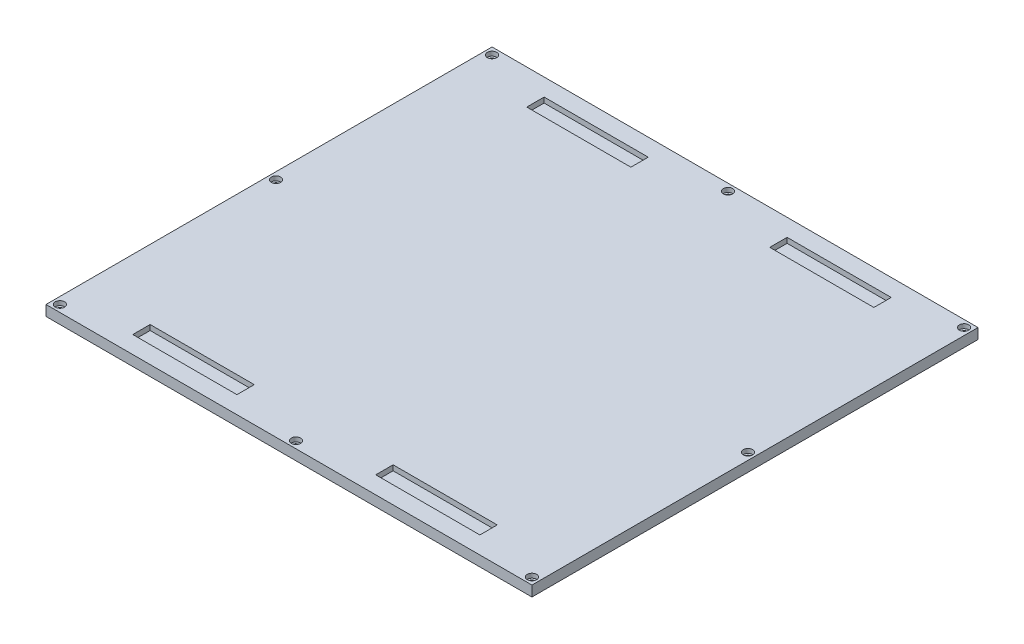
from build123d import *

# Parameters (mm, degrees)
SKETCH1_W           = 280
SKETCH1_H           = 257
BOSS_EXTRUDE2_DEPTH = 6
SKETCH3_R           = 1.45
CUT_EXTRUDE1_DEPTH  = 381.111825651
SKETCH4_R           = 2.7
CUT_EXTRUDE4_DEPTH  = 2.5
SKETCH8_W           = 60
SKETCH8_H           = 10
CUT_EXTRUDE5_DEPTH  = 3


with BuildPart() as part:
    # Sketch1 → Boss-Extrude2 (new body)
    with BuildSketch(Plane(origin=(0, 0, 0), x_dir=(1, 0, 0), z_dir=(0, 1, 0))):
        with Locations((140, 128.5)):
            Rectangle(SKETCH1_W, SKETCH1_H)
    extrude(amount=BOSS_EXTRUDE2_DEPTH)

    # Sketch3 → Cut-Extrude1 (cut, through all)
    with BuildSketch(Plane(origin=(0, 6, 0), x_dir=(1, 0, 0), z_dir=(0, 1, 0))):
        with Locations(Location((4.002224382, 252.997775618, 0), (0, 0, 270))):
            Circle(SKETCH3_R)
        with Locations(Location((275.997775618, 252.997775618, 0), (0, 0, 270))):
            Circle(SKETCH3_R)
        with Locations(Location((4.002224382, 4.002224382, 0), (0, 0, 270))):
            Circle(SKETCH3_R)
        with Locations(Location((275.997775618, 4.002224382, 0), (0, 0, 270))):
            Circle(SKETCH3_R)
        with Locations(Location((4.002224382, 128.5, 0), (0, 0, 270))):
            Circle(SKETCH3_R)
        with Locations(Location((275.997775618, 128.5, 0), (0, 0, 270))):
            Circle(SKETCH3_R)
        with Locations(Location((140, 4.002224382, 0), (0, 0, 270))):
            Circle(SKETCH3_R)
        with Locations(Location((140, 252.997775618, 0), (0, 0, 270))):
            Circle(SKETCH3_R)
    extrude(amount=-CUT_EXTRUDE1_DEPTH, mode=Mode.SUBTRACT)

    # Sketch4 → Cut-Extrude4 (cut)
    with BuildSketch(Plane(origin=(0, 6, 0), x_dir=(1, 0, 0), z_dir=(0, 1, 0))):
        with Locations(Location((4.002224382, 4.002224382, 0), (0, 0, 270))):
            Circle(SKETCH4_R)
        with Locations(Location((4.002224382, 252.997775618, 0), (0, 0, 270))):
            Circle(SKETCH4_R)
        with Locations(Location((275.997775618, 252.997775618, 0), (0, 0, 270))):
            Circle(SKETCH4_R)
        with Locations(Location((275.997775618, 4.002224382, 0), (0, 0, 270))):
            Circle(SKETCH4_R)
        with Locations(Location((4.002224382, 128.5, 0), (0, 0, 270))):
            Circle(SKETCH4_R)
        with Locations(Location((275.997775618, 128.5, 0), (0, 0, 270))):
            Circle(SKETCH4_R)
        with Locations(Location((140, 252.997775618, 0), (0, 0, 270))):
            Circle(SKETCH4_R)
        with Locations(Location((140, 4.002224382, 0), (0, 0, 270))):
            Circle(SKETCH4_R)
    extrude(amount=-CUT_EXTRUDE4_DEPTH, mode=Mode.SUBTRACT)

    # Sketch8 → Cut-Extrude5 (cut)
    with BuildSketch(Plane(origin=(0, 6, 0), x_dir=(1, 0, 0), z_dir=(0, 1, 0))):
        with Locations((70, 242)):
            Rectangle(SKETCH8_W, SKETCH8_H)
        with Locations((70, 14.997514144)):
            Rectangle(SKETCH8_W, SKETCH8_H)
        with Locations((210, 14.997514144)):
            Rectangle(SKETCH8_W, SKETCH8_H)
        with Locations((210, 242)):
            Rectangle(SKETCH8_W, SKETCH8_H)
    extrude(amount=-CUT_EXTRUDE5_DEPTH, mode=Mode.SUBTRACT)


solid = part.part
